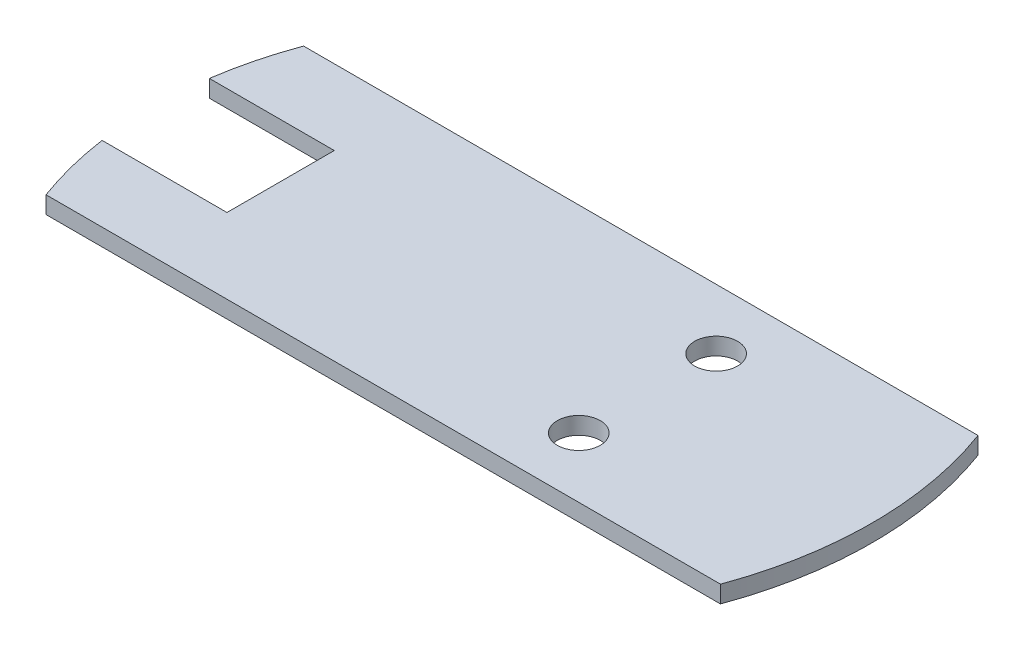
from build123d import *

# Parameters (mm, degrees)
BOSS_EXTRUDE1_DEPTH = 1
CUT_EXTRUDE1_REACH  = 46.596
SKETCH2_W           = 30
SKETCH2_H           = 12.5
CUT_EXTRUDE2_REACH  = 46.596
SKETCH3_R           = 2.5


with BuildPart() as part:
    # Sketch1 → Boss-Extrude1 (new, symmetric)
    with BuildSketch(Plane(origin=(0, 0, 0), x_dir=(1, 0, 0), z_dir=(0, 1, 0))):
        with BuildLine():
            Line((-39.278701549, 15), (39.278701549, 15))
            ThreePointArc((39.278701549, 15), (41.95, 0), (39.278701549, -15))
            Line((39.278701549, -15), (-39.278701549, -15))
            ThreePointArc((-39.278701549, -15), (-41.95, 0), (-39.278701549, 15))
        make_face()
    extrude(amount=BOSS_EXTRUDE1_DEPTH, both=True)

    # Sketch2 → Cut-Extrude1 (cut, up to next)
    with BuildSketch(Plane(origin=(0, 1, 0), x_dir=(1, 0, 0), z_dir=(0, 1, 0)), mode=Mode.PRIVATE) as cut_extrude1_sk1:
        with Locations((-41.95, 0)):
            Rectangle(SKETCH2_W, SKETCH2_H)
    cut_extrude1_tool1 = extrude(cut_extrude1_sk1.sketch, amount=-CUT_EXTRUDE1_REACH, mode=Mode.PRIVATE) & part.part
    add(cut_extrude1_tool1.solids().sort_by_distance((-41.95, 1, 0))[0], mode=Mode.SUBTRACT)

    # Sketch3 → Cut-Extrude2 (cut, up to next)
    with BuildSketch(Plane.XZ.offset(1), mode=Mode.PRIVATE) as cut_extrude2_sk1:
        with Locations(Location((15.778701549, 8, 0), (0, 0, 270))):
            Circle(SKETCH3_R)
    cut_extrude2_tool1 = extrude(cut_extrude2_sk1.sketch, amount=-CUT_EXTRUDE2_REACH, mode=Mode.PRIVATE) & part.part
    # Sketch3 → Cut-Extrude2 (cut, up to next)
    with BuildSketch(Plane.XZ.offset(1), mode=Mode.PRIVATE) as cut_extrude2_sk2:
        with Locations(Location((15.778701549, -8, 0), (0, 0, 270))):
            Circle(SKETCH3_R)
    cut_extrude2_tool2 = extrude(cut_extrude2_sk2.sketch, amount=-CUT_EXTRUDE2_REACH, mode=Mode.PRIVATE) & part.part
    add(cut_extrude2_tool1.solids().sort_by_distance((15.778702, -1, 8))[0], mode=Mode.SUBTRACT)
    add(cut_extrude2_tool2.solids().sort_by_distance((15.778702, -1, -8))[0], mode=Mode.SUBTRACT)


solid = part.part
